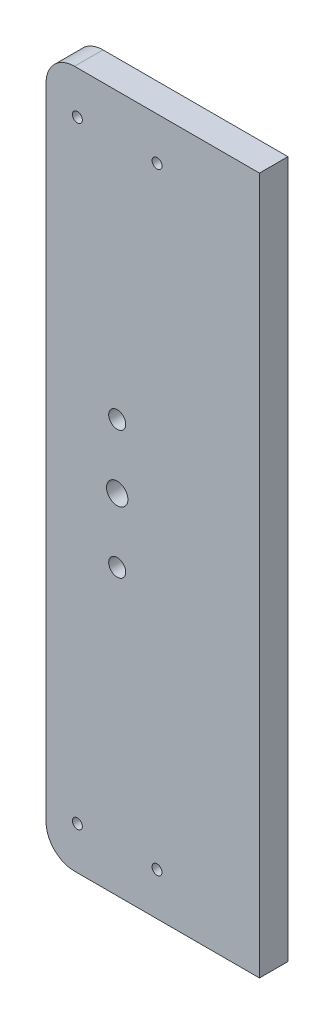
from build123d import *

# Parameters (mm, degrees)
SKETCH_1_W      = 150
SKETCH_1_H      = 490
SKETCH_1_R      = 3.5
SKETCH_1_R_2    = 6
SKETCH_1_R_3    = 7.5
EXTRUDE_1_DEPTH = 20
FILLET_1_R      = 20


with BuildPart() as part:
    # Эскиз1 → Бобышка-Вытянуть1 (new body)
    with BuildSketch(Plane.XY):
        with Locations((25, 0)):
            Rectangle(SKETCH_1_W, SKETCH_1_H)
        with Locations((-28, -215)):
            Circle(SKETCH_1_R, mode=Mode.SUBTRACT)
        with Locations((0, -45)):
            Circle(SKETCH_1_R_2, mode=Mode.SUBTRACT)
        with Locations((28, -215)):
            Circle(SKETCH_1_R, mode=Mode.SUBTRACT)
        Circle(SKETCH_1_R_3, mode=Mode.SUBTRACT)
        with Locations((0, 45)):
            Circle(SKETCH_1_R_2, mode=Mode.SUBTRACT)
        with Locations((-28, 215)):
            Circle(SKETCH_1_R, mode=Mode.SUBTRACT)
        with Locations((28, 215)):
            Circle(SKETCH_1_R, mode=Mode.SUBTRACT)
    extrude(amount=EXTRUDE_1_DEPTH)

    # Скругление1
    fillet_1_edges = [part.edges().sort_by_distance(p)[0] for p in [
        (-50, 245, 10),
        (-50, -245, 10),
    ]]
    fillet(fillet_1_edges, radius=FILLET_1_R)


solid = part.part
